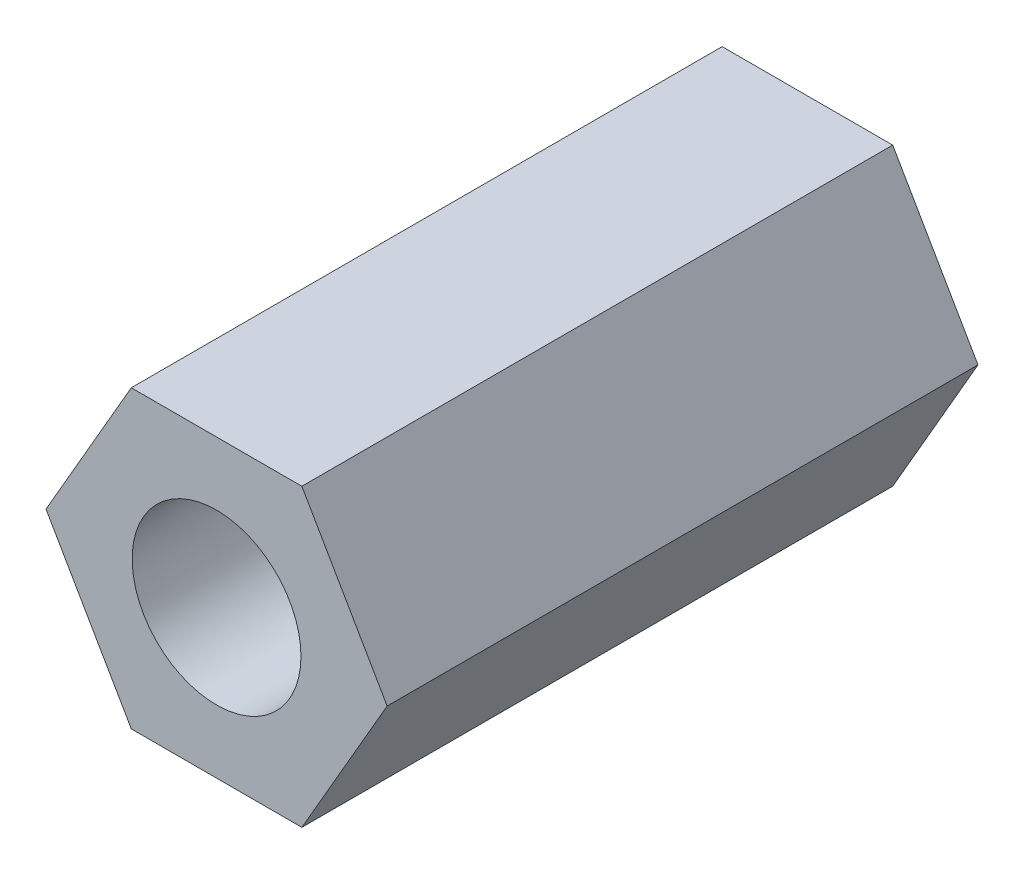
from build123d import *

# Parameters (mm, degrees)
ESTRUSIONE_ESTRUSIONE1_DEPTH = 14
SCHIZZO2_R                   = 2
TAGLIO_ESTRUSIONE1_DEPTH     = 15


with BuildPart() as part:
    # Schizzo1 → Estrusione-Estrusione1 (new body)
    with BuildSketch(Plane.XY):
        Polygon((2.020725942, 3.5), (-2.020725942, 3.5), (-4.041451884, 0), (-2.020725942, -3.5), (2.020725942, -3.5), (4.041451884, 0), align=None)
    extrude(amount=ESTRUSIONE_ESTRUSIONE1_DEPTH)

    # Schizzo2 → Taglio-Estrusione1 (cut)
    with BuildSketch(Plane.XY.offset(14)):
        Circle(SCHIZZO2_R)
    extrude(amount=-TAGLIO_ESTRUSIONE1_DEPTH, mode=Mode.SUBTRACT)


solid = part.part
